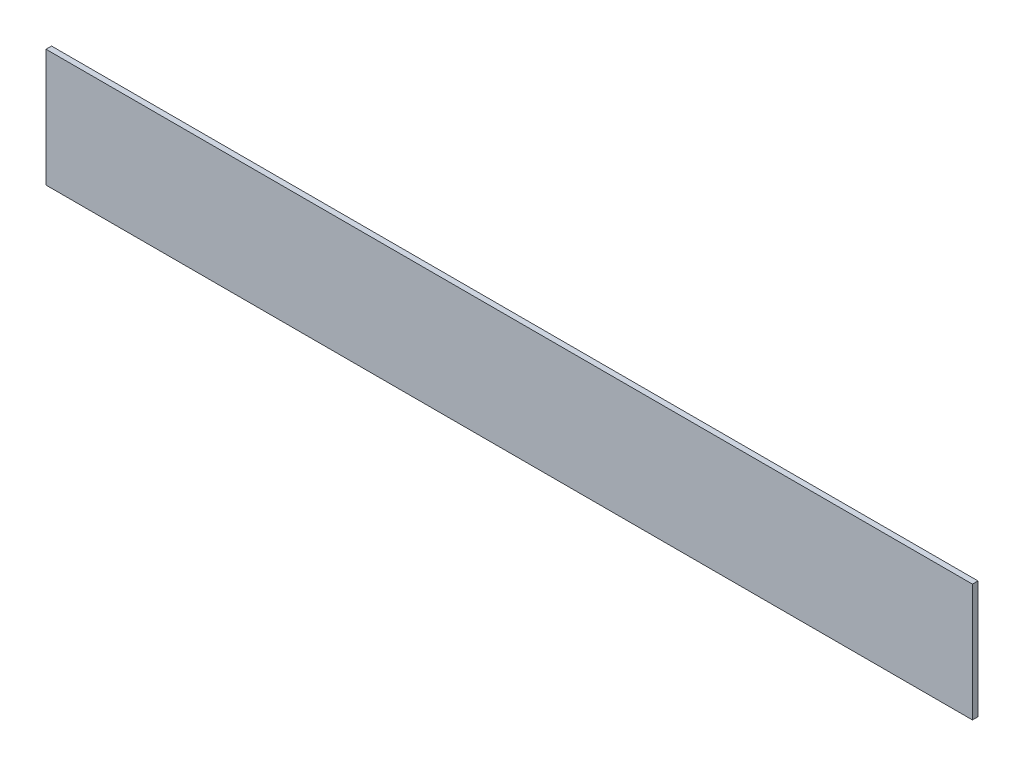
from build123d import *

# Parameters (mm, degrees)
ESBO_O1_W                = 100
ESBO_O1_H                = 18
RESSALTO_EXTRUS_O1_DEPTH = 0.6
ESBO_O2_W                = 0.6
ESBO_O2_H                = 3.5
CORTE_EXTRUS_O1_DEPTH    = 100
ESBO_O5_W                = 109.434342877
ESBO_O5_H                = 1.8
CORTE_EXTRUS_O4_DEPTH    = 100


with BuildPart() as part:
    # Esboço1 → Ressalto-extrusão1 (new body)
    with BuildSketch(Plane.XY):
        with Locations((-2.788473849, 8.133956386)):
            Rectangle(ESBO_O1_W, ESBO_O1_H)
    extrude(amount=RESSALTO_EXTRUS_O1_DEPTH)

    # Esboço2 → Corte-extrusão1 (cut)
    with BuildSketch(Plane.ZY.offset(52.788473849)):
        with Locations((0.3, 0.883956386)):
            Rectangle(ESBO_O2_W, ESBO_O2_H)
    extrude(amount=-CORTE_EXTRUS_O1_DEPTH, mode=Mode.SUBTRACT)

    # Esboço5 → Corte-extrusão4 (cut)
    with BuildSketch(Plane(origin=(0, 0, 0), x_dir=(-1, 0, 0), z_dir=(0, 0, -1))):
        with Locations((1.545585964, 3.533956386)):
            Rectangle(ESBO_O5_W, ESBO_O5_H)
    extrude(amount=-CORTE_EXTRUS_O4_DEPTH, mode=Mode.SUBTRACT)


solid = part.part
